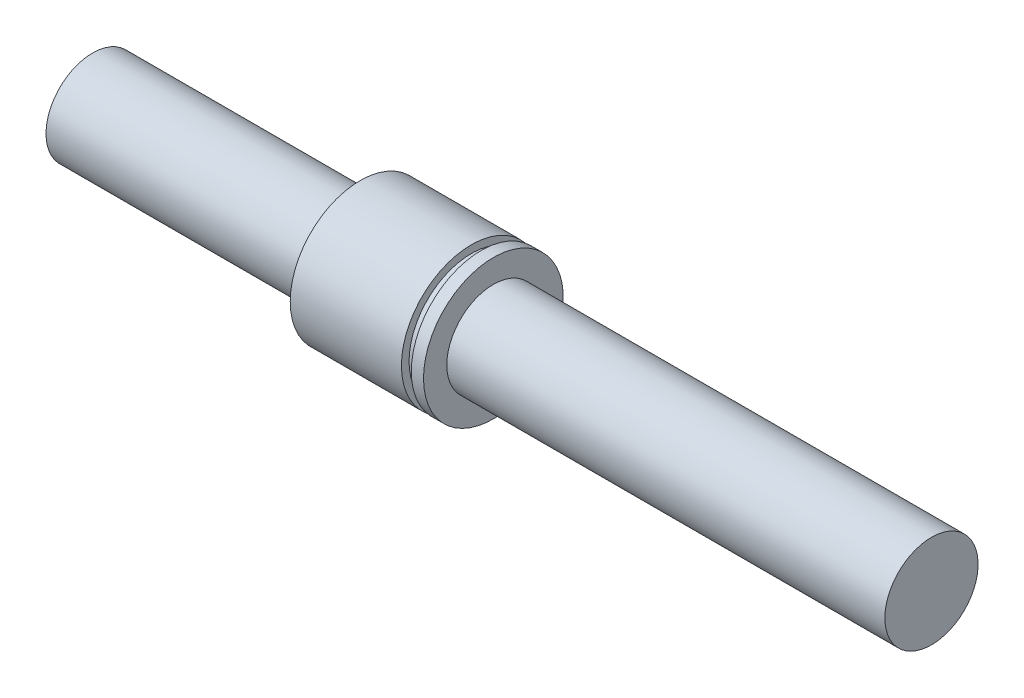
from build123d import *


with BuildPart() as part:
    # Sketch1 → Revolve1 (revolve)
    with BuildSketch(Plane.XY, mode=Mode.PRIVATE) as revolve1_sk:
        Polygon((-63.186598296, 5.65643437), (-63.186598296, 0.65643437), (26.813401704, 0.65643437), (26.813401704, 5.65643437), (-20.186598296, 5.65643437), (-20.186598296, 8.15643437), (-21.497097826, 8.15643437), (-21.497097826, 7.338058616), (-22.554601282, 7.338058616), (-22.554601282, 8.15643437), (-34.484416001, 8.15643437), (-34.484416001, 5.65643437), align=None)
    revolve(revolve1_sk.sketch.rotate(Axis((-63.186598296, 0.65643437, 0), (1, 0, 0)), 90), axis=Axis((-63.186598296, 0.65643437, 0), (1, 0, 0)))


solid = part.part
